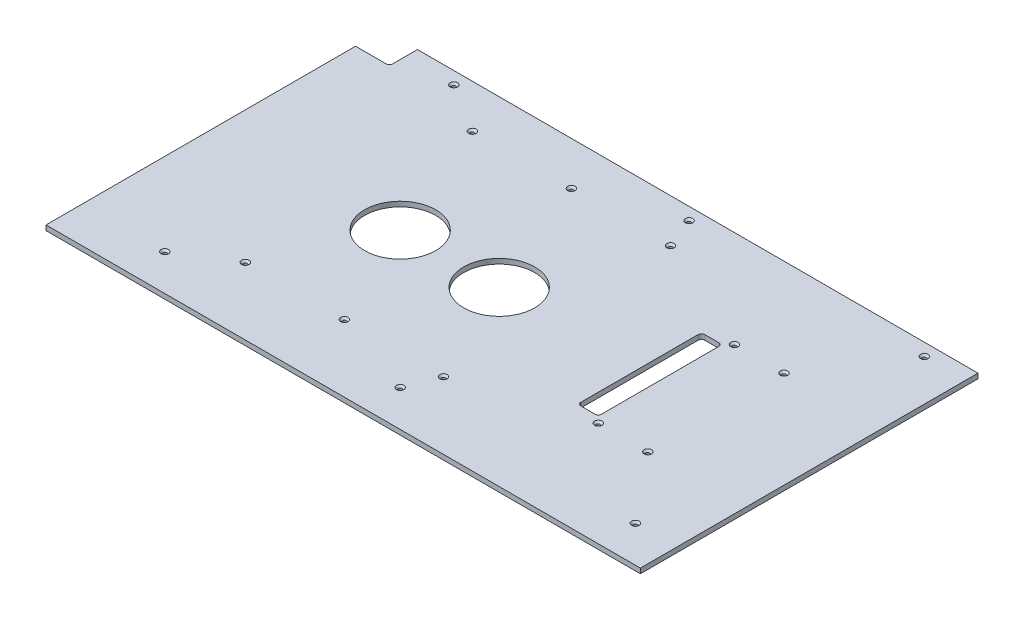
from build123d import *

# Parameters (mm, degrees)
SKETCH1_W           = 720
SKETCH1_H           = 409
BOSS_EXTRUDE1_DEPTH = 3
CUT_EXTRUDE2_DEPTH  = 415.072759307
CUT_EXTRUDE3_DEPTH  = 415.072759307
SKETCH7_R           = 2.25
CUT_EXTRUDE4_DEPTH  = 415.072759307
SKETCH9_R           = 43
CUT_EXTRUDE6_DEPTH  = 415.072759308


with BuildPart() as part:
    # Sketch1 → Boss-Extrude1 (new, symmetric)
    with BuildSketch(Plane(origin=(0, 0, 0), x_dir=(1, 0, 0), z_dir=(0, 1, 0))):
        Rectangle(SKETCH1_W, SKETCH1_H)
    extrude(amount=BOSS_EXTRUDE1_DEPTH, both=True)

    # Sketch5 → Cut-Extrude2 (cut, through all)
    with BuildSketch(Plane(origin=(0, 3, 0), x_dir=(1, 0, 0), z_dir=(0, 1, 0))):
        with BuildLine():
            Line((154, 79.5), (171, 79.5))
            ThreePointArc((171, 79.5), (173.828427125, 78.328427125), (175, 75.5))
            Line((175, 75.5), (175, -66.5))
            ThreePointArc((175, -66.5), (173.828427125, -69.328427125), (171, -70.5))
            Line((171, -70.5), (154, -70.5))
            ThreePointArc((154, -70.5), (151.171572875, -69.328427125), (150, -66.5))
            Line((150, -66.5), (150, 75.5))
            ThreePointArc((150, 75.5), (151.171572875, 78.328427125), (154, 79.5))
        make_face()
    extrude(amount=-CUT_EXTRUDE2_DEPTH, mode=Mode.SUBTRACT)

    # Sketch6 → Cut-Extrude3 (cut, through all)
    with BuildSketch(Plane(origin=(0, 3, 0), x_dir=(1, 0, 0), z_dir=(0, 1, 0))):
        with BuildLine():
            Line((-360, 204.5), (-319, 204.5))
            Line((-319, 204.5), (-319, 174.5))
            ThreePointArc((-319, 174.5), (-320.171572875, 171.671572875), (-323, 170.5))
            Line((-323, 170.5), (-360, 170.5))
            Line((-360, 170.5), (-360, 204.5))
        make_face()
    extrude(amount=-CUT_EXTRUDE3_DEPTH, mode=Mode.SUBTRACT)

    # Sketch7 → Cut-Extrude4 (cut, through all)
    with BuildSketch(Plane(origin=(0, 3, 0), x_dir=(1, 0, 0), z_dir=(0, 1, 0))):
        with Locations(Location((-260, 189.5, 0), (0, 0, 270))):
            Circle(SKETCH7_R)
        with Locations(Location((25, 189.5, 0), (0, 0, 270))):
            Circle(SKETCH7_R)
        with Locations(Location((310, 189.5, 0), (0, 0, 270))):
            Circle(SKETCH7_R)
        with Locations(Location((310, -160.5, 0), (0, 0, 90))):
            Circle(SKETCH7_R)
        with Locations(Location((25, -160.5, 0), (0, 0, 90))):
            Circle(SKETCH7_R)
        with Locations(Location((-260, -160.5, 0), (0, 0, 90))):
            Circle(SKETCH7_R)
        with Locations(Location((-200, 152, 0), (0, 0, 270))):
            Circle(SKETCH7_R)
        with Locations(Location((-200, -123, 0), (0, 0, 270))):
            Circle(SKETCH7_R)
        with Locations(Location((-80, 152, 0), (0, 0, 270))):
            Circle(SKETCH7_R)
        with Locations(Location((-80, -123, 0), (0, 0, 270))):
            Circle(SKETCH7_R)
        with Locations(Location((40, 152, 0), (0, 0, 270))):
            Circle(SKETCH7_R)
        with Locations(Location((40, -123, 0), (0, 0, 270))):
            Circle(SKETCH7_R)
        with Locations(Location((182.5, 87, 0), (0, 0, 270))):
            Circle(SKETCH7_R)
        with Locations(Location((242.5, 87, 0), (0, 0, 270))):
            Circle(SKETCH7_R)
        with Locations(Location((242.5, -78, 0), (0, 0, 270))):
            Circle(SKETCH7_R)
        with Locations(Location((182.5, -78, 0), (0, 0, 270))):
            Circle(SKETCH7_R)
    extrude(amount=-CUT_EXTRUDE4_DEPTH, mode=Mode.SUBTRACT)

    # Cut-Extrude5 cone 1 section (through the dimple's axis) → Cut-Extrude5 (revolve, cut)
    with BuildSketch(Plane(origin=(-260, 3, -189.5), x_dir=(0, 0, 1), z_dir=(1, 0, 0))):
        Polygon((0, 0), (4.5, 0), (0, 4.5), align=None)
    revolve(axis=Axis((-260, 3, -189.5), (0, -1, 0)), mode=Mode.SUBTRACT)

    # Cut-Extrude5 cone 2 section (through the dimple's axis) → Cut-Extrude5 cone 2 (revolve, cut)
    with BuildSketch(Plane(origin=(-200, 3, -152), x_dir=(0, 0, 1), z_dir=(1, 0, 0))):
        Polygon((0, 0), (4.5, 0), (0, 4.5), align=None)
    revolve(axis=Axis((-200, 3, -152), (0, -1, 0)), mode=Mode.SUBTRACT)

    # Cut-Extrude5 cone 3 section (through the dimple's axis) → Cut-Extrude5 cone 3 (revolve, cut)
    with BuildSketch(Plane(origin=(-80, 3, -152), x_dir=(0, 0, 1), z_dir=(1, 0, 0))):
        Polygon((0, 0), (4.5, 0), (0, 4.5), align=None)
    revolve(axis=Axis((-80, 3, -152), (0, -1, 0)), mode=Mode.SUBTRACT)

    # Cut-Extrude5 cone 4 section (through the dimple's axis) → Cut-Extrude5 cone 4 (revolve, cut)
    with BuildSketch(Plane(origin=(25, 3, -189.5), x_dir=(0, 0, 1), z_dir=(1, 0, 0))):
        Polygon((0, 0), (4.5, 0), (0, 4.5), align=None)
    revolve(axis=Axis((25, 3, -189.5), (0, -1, 0)), mode=Mode.SUBTRACT)

    # Cut-Extrude5 cone 5 section (through the dimple's axis) → Cut-Extrude5 cone 5 (revolve, cut)
    with BuildSketch(Plane(origin=(40, 3, -152), x_dir=(0, 0, 1), z_dir=(1, 0, 0))):
        Polygon((0, 0), (4.5, 0), (0, 4.5), align=None)
    revolve(axis=Axis((40, 3, -152), (0, -1, 0)), mode=Mode.SUBTRACT)

    # Cut-Extrude5 cone 6 section (through the dimple's axis) → Cut-Extrude5 cone 6 (revolve, cut)
    with BuildSketch(Plane(origin=(310, 3, -189.5), x_dir=(0, 0, 1), z_dir=(1, 0, 0))):
        Polygon((0, 0), (4.5, 0), (0, 4.5), align=None)
    revolve(axis=Axis((310, 3, -189.5), (0, -1, 0)), mode=Mode.SUBTRACT)

    # Cut-Extrude5 cone 7 section (through the dimple's axis) → Cut-Extrude5 cone 7 (revolve, cut)
    with BuildSketch(Plane(origin=(-200, 3, 123), x_dir=(0, 0, 1), z_dir=(1, 0, 0))):
        Polygon((0, 0), (4.5, 0), (0, 4.5), align=None)
    revolve(axis=Axis((-200, 3, 123), (0, -1, 0)), mode=Mode.SUBTRACT)

    # Cut-Extrude5 cone 8 section (through the dimple's axis) → Cut-Extrude5 cone 8 (revolve, cut)
    with BuildSketch(Plane(origin=(-260, 3, 160.5), x_dir=(0, 0, 1), z_dir=(1, 0, 0))):
        Polygon((0, 0), (4.5, 0), (0, 4.5), align=None)
    revolve(axis=Axis((-260, 3, 160.5), (0, -1, 0)), mode=Mode.SUBTRACT)

    # Cut-Extrude5 cone 9 section (through the dimple's axis) → Cut-Extrude5 cone 9 (revolve, cut)
    with BuildSketch(Plane(origin=(-80, 3, 123), x_dir=(0, 0, 1), z_dir=(1, 0, 0))):
        Polygon((0, 0), (4.5, 0), (0, 4.5), align=None)
    revolve(axis=Axis((-80, 3, 123), (0, -1, 0)), mode=Mode.SUBTRACT)

    # Cut-Extrude5 cone 10 section (through the dimple's axis) → Cut-Extrude5 cone 10 (revolve, cut)
    with BuildSketch(Plane(origin=(25, 3, 160.5), x_dir=(0, 0, 1), z_dir=(1, 0, 0))):
        Polygon((0, 0), (4.5, 0), (0, 4.5), align=None)
    revolve(axis=Axis((25, 3, 160.5), (0, -1, 0)), mode=Mode.SUBTRACT)

    # Cut-Extrude5 cone 11 section (through the dimple's axis) → Cut-Extrude5 cone 11 (revolve, cut)
    with BuildSketch(Plane(origin=(40, 3, 123), x_dir=(0, 0, 1), z_dir=(1, 0, 0))):
        Polygon((0, 0), (4.5, 0), (0, 4.5), align=None)
    revolve(axis=Axis((40, 3, 123), (0, -1, 0)), mode=Mode.SUBTRACT)

    # Cut-Extrude5 cone 12 section (through the dimple's axis) → Cut-Extrude5 cone 12 (revolve, cut)
    with BuildSketch(Plane(origin=(310, 3, 160.5), x_dir=(0, 0, 1), z_dir=(1, 0, 0))):
        Polygon((0, 0), (4.5, 0), (0, 4.5), align=None)
    revolve(axis=Axis((310, 3, 160.5), (0, -1, 0)), mode=Mode.SUBTRACT)

    # Cut-Extrude5 cone 13 section (through the dimple's axis) → Cut-Extrude5 cone 13 (revolve, cut)
    with BuildSketch(Plane(origin=(182.5, 3, -87), x_dir=(0, 0, 1), z_dir=(1, 0, 0))):
        Polygon((0, 0), (4.5, 0), (0, 4.5), align=None)
    revolve(axis=Axis((182.5, 3, -87), (0, -1, 0)), mode=Mode.SUBTRACT)

    # Cut-Extrude5 cone 14 section (through the dimple's axis) → Cut-Extrude5 cone 14 (revolve, cut)
    with BuildSketch(Plane(origin=(242.5, 3, -87), x_dir=(0, 0, 1), z_dir=(1, 0, 0))):
        Polygon((0, 0), (4.5, 0), (0, 4.5), align=None)
    revolve(axis=Axis((242.5, 3, -87), (0, -1, 0)), mode=Mode.SUBTRACT)

    # Cut-Extrude5 cone 15 section (through the dimple's axis) → Cut-Extrude5 cone 15 (revolve, cut)
    with BuildSketch(Plane(origin=(182.5, 3, 78), x_dir=(0, 0, 1), z_dir=(1, 0, 0))):
        Polygon((0, 0), (4.5, 0), (0, 4.5), align=None)
    revolve(axis=Axis((182.5, 3, 78), (0, -1, 0)), mode=Mode.SUBTRACT)

    # Cut-Extrude5 cone 16 section (through the dimple's axis) → Cut-Extrude5 cone 16 (revolve, cut)
    with BuildSketch(Plane(origin=(242.5, 3, 78), x_dir=(0, 0, 1), z_dir=(1, 0, 0))):
        Polygon((0, 0), (4.5, 0), (0, 4.5), align=None)
    revolve(axis=Axis((242.5, 3, 78), (0, -1, 0)), mode=Mode.SUBTRACT)

    # Sketch9 → Cut-Extrude6 (cut, through all)
    with BuildSketch(Plane(origin=(0, 3, 0), x_dir=(1, 0, 0), z_dir=(0, 1, 0))):
        with Locations(Location((-20, 4.5, 0), (0, 0, 270))):
            Circle(SKETCH9_R)
        with Locations(Location((-140, 4.5, 0), (0, 0, 270))):
            Circle(SKETCH9_R)
    extrude(amount=-CUT_EXTRUDE6_DEPTH, mode=Mode.SUBTRACT)


solid = part.part
